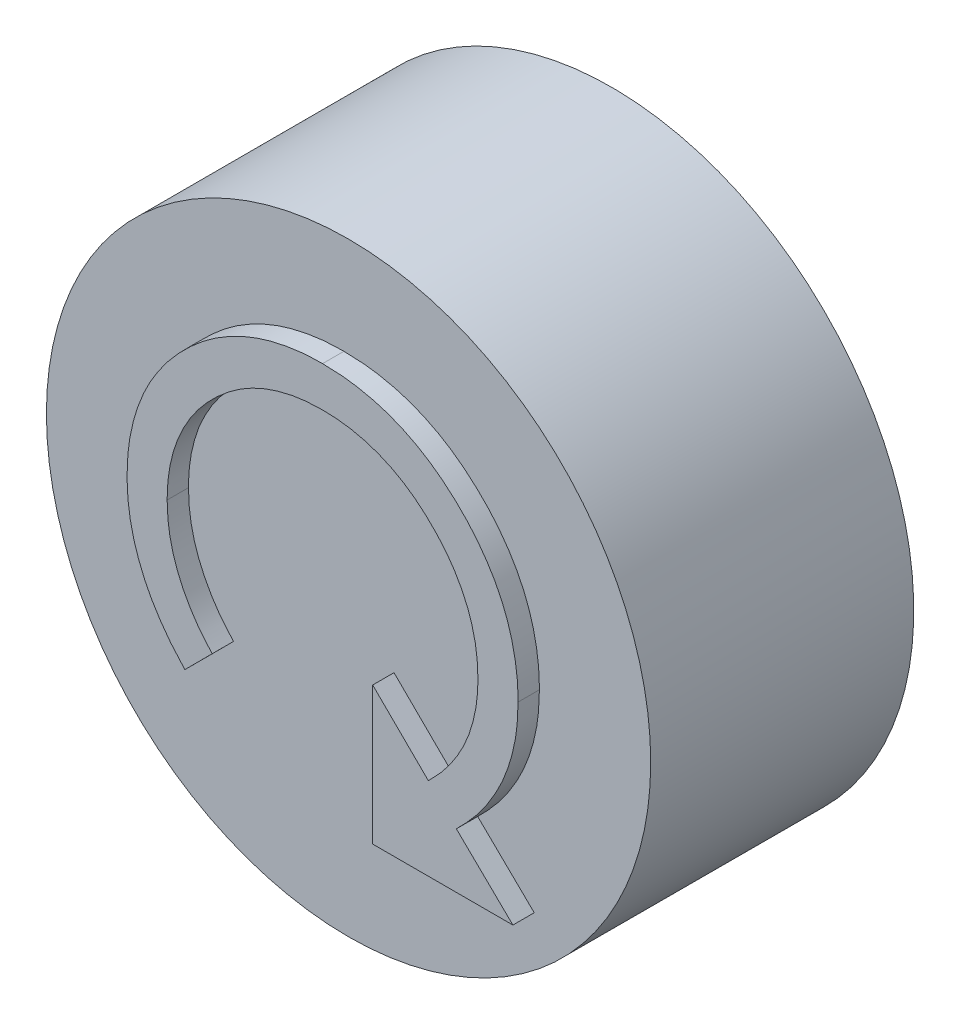
from build123d import *

# Parameters (mm, degrees)
SKETCH1_R           = 8.5
BOSS_EXTRUDE1_DEPTH = 4.4
SKETCH3_R           = 5.8
CUT_EXTRUDE1_DEPTH  = 4
BOSS_EXTRUDE3_START = 3
SKETCH4_R           = 8.5
SKETCH4_R_2         = 7.5
BOSS_EXTRUDE3_DEPTH = 3
BOSS_EXTRUDE4_DEPTH = 0.6


with BuildPart() as part:
    # Sketch1 → Boss-Extrude1 (new body)
    with BuildSketch(Plane.XY):
        Circle(SKETCH1_R)
    extrude(amount=BOSS_EXTRUDE1_DEPTH)

    # Sketch3 → Cut-Extrude1 (cut)
    with BuildSketch(Plane(origin=(0, 0, 0), x_dir=(-1, 0, 0), z_dir=(0, 0, -1))):
        Circle(SKETCH3_R)
    extrude(amount=-CUT_EXTRUDE1_DEPTH, mode=Mode.SUBTRACT)

    # Sketch4 → Boss-Extrude3 (add)
    with BuildSketch(Plane(origin=(0, 0, 0), x_dir=(-1, 0, 0), z_dir=(0, 0, -1)).offset(BOSS_EXTRUDE3_START)):
        Circle(SKETCH4_R)
        Circle(SKETCH4_R_2, mode=Mode.SUBTRACT)
    extrude(amount=-BOSS_EXTRUDE3_DEPTH)

    # Sketch6 → Cut-Revolve1 (revolve, cut)
    with BuildSketch(Plane(origin=(0, 0, 0), x_dir=(1, 0, 0), z_dir=(0, 1, 0)), mode=Mode.PRIVATE) as cut_revolve1_sk:
        Polygon((7.5, 0), (5.8, -1.7), (5.8, 0), align=None)
    revolve(cut_revolve1_sk.sketch.rotate(Axis((0, 0, -5.5), (0, 0, 1)), 180), axis=Axis((0, 0, -5.5), (0, 0, 1)), mode=Mode.SUBTRACT)

    # Sketch2 → Boss-Extrude4 (add)
    with BuildSketch(Plane.XY.offset(4.4)):
        with BuildLine():
            Line((3.632089791, -3.751482391), (5.223035304, -5.300560917))
            Line((5.223035304, -5.300560917), (1.278724407, -5.300560917))
            Line((1.278724407, -5.300560917), (1.278724407, -1.424559314))
            Line((1.278724407, -1.424559314), (2.845431137, -2.97363784))
            add(Edge.make_bspline(
                [(2.845431137, -2.97363784), (2.95632075, -2.861034584), (3.174405253, -2.639579891), (3.459213248, -2.278430368), (3.70074243, -1.902868481), (3.898794049, -1.512590066), (4.05164193, -1.107607515), (4.159151203, -0.687847174), (4.228166952, -0.253828699), (4.236197805, 0.041257842), (4.240262868, 0.190624981)],
                knots=[0, 0, 0, 0, 1.065567823, 2.095632081, 3.096325677, 4.073630942, 5.042774034, 6.010294195, 6.992849145, 8, 8, 8, 8], degree=3))
            add(Edge.make_bspline(
                [(4.240262868, 0.190624981), (4.236521971, 0.339185131), (4.229157297, 0.631654273), (4.16882099, 1.061635432), (4.066106532, 1.474567413), (3.926128217, 1.87176171), (3.742510622, 2.251822429), (3.522034828, 2.616182439), (3.260511136, 2.964392602), (2.959512286, 3.288301222), (2.634991287, 3.589186758), (2.288400016, 3.852429668), (1.924418043, 4.074704619), (1.543968163, 4.255940011), (1.147484032, 4.397650491), (0.735726783, 4.499431142), (0.30732266, 4.560199144), (0.016301238, 4.567516752), (-0.131532004, 4.571233955)],
                knots=[0, 0, 0, 0, 1.036283767, 2.0401233, 3.022098945, 4.001181535, 4.973115426, 5.961928152, 6.96848522, 8.005845645, 9.043206071, 10.052850644, 11.037284036, 12.013841621, 12.988096842, 13.970072486, 14.968836162, 16, 16, 16, 16], degree=3))
            add(Edge.make_bspline(
                [(-0.131532004, 4.571233955), (-0.280088337, 4.567459865), (-0.573277686, 4.560011356), (-1.00473588, 4.499828874), (-1.418221214, 4.397341401), (-1.816346635, 4.258767128), (-2.196115848, 4.076581392), (-2.560226583, 3.855519569), (-2.903891125, 3.590363046), (-3.230152733, 3.293680989), (-3.527552899, 2.967768525), (-3.790083641, 2.621418652), (-4.007152184, 2.255441675), (-4.192132355, 1.876734755), (-4.328849407, 1.477819774), (-4.432036389, 1.063874926), (-4.49207445, 0.632358672), (-4.499542755, 0.339177282), (-4.503326876, 0.190624981)],
                knots=[0, 0, 0, 0, 1.035427484, 2.043509704, 3.02964574, 4.001383878, 4.977134532, 5.960754486, 6.96548856, 7.998532717, 9.031576874, 10.037302222, 11.022653504, 11.993784286, 12.97035426, 13.956490296, 14.964572516, 16, 16, 16, 16], degree=3))
            add(Edge.make_bspline(
                [(-4.503326876, 0.190624981), (-4.499608767, 0.046452954), (-4.492253992, -0.238733168), (-4.430784866, -0.659467236), (-4.331445734, -1.067569513), (-4.19188491, -1.463967176), (-4.01175723, -1.848290505), (-3.795509518, -2.222691708), (-3.53699416, -2.583569925), (-3.337577276, -2.80718571), (-3.236299632, -2.920753225)],
                knots=[0, 0, 0, 0, 1.00470997, 1.987412856, 2.957385615, 3.929100441, 4.911910053, 5.912278307, 6.939710965, 8, 8, 8, 8], degree=3))
            Line((-3.236299632, -2.920753225), (-4.005330081, -3.691987199))
            add(Edge.make_bspline(
                [(-4.005330081, -3.691987199), (-4.135271474, -3.549666878), (-4.391109201, -3.269456652), (-4.719311464, -2.815225768), (-5.004332233, -2.351060045), (-5.230143754, -1.867949003), (-5.411519251, -1.371567784), (-5.538708635, -0.859768832), (-5.615741653, -0.332482335), (-5.62622625, 0.023633109), (-5.631532004, 0.203846134)],
                knots=[0, 0, 0, 0, 1.067518229, 2.101804739, 3.101067448, 4.082788766, 5.052650977, 6.026360255, 7.001235147, 8, 8, 8, 8], degree=3))
            add(Edge.make_bspline(
                [(-5.631532004, 0.203846134), (-5.627457502, 0.390708619), (-5.619432553, 0.758744313), (-5.538520982, 1.298672582), (-5.414249777, 1.818110739), (-5.235843212, 2.315782791), (-5.011649393, 2.795149888), (-4.73042278, 3.250028561), (-4.403608666, 3.686459458), (-4.028557339, 4.094332656), (-3.619894559, 4.468793147), (-3.185532677, 4.799872374), (-2.726214157, 5.075680655), (-2.248647615, 5.304538365), (-1.749434149, 5.482282496), (-1.22855864, 5.606437585), (-0.687143546, 5.687225777), (-0.318389709, 5.695331626), (-0.131532004, 5.699439083)],
                knots=[0, 0, 0, 0, 1.036548909, 2.041538722, 3.023471865, 3.997074745, 4.970976362, 5.955504589, 6.960097362, 7.993216813, 9.026336264, 10.033383207, 11.019278073, 11.994927594, 12.968530475, 13.95442534, 14.963451091, 16, 16, 16, 16], degree=3))
            add(Edge.make_bspline(
                [(-0.131532004, 5.699439083), (0.054595523, 5.695345882), (0.421895617, 5.687268445), (0.961779629, 5.606175508), (1.481981128, 5.482330381), (1.981120847, 5.30443921), (2.458381777, 5.076303735), (2.916213765, 4.799218389), (3.350458552, 4.468265022), (3.760990035, 4.094356336), (4.138315988, 3.687117495), (4.465256719, 3.250043032), (4.745894958, 2.794580246), (4.973314126, 2.316382013), (5.151012636, 1.818029141), (5.275504478, 1.29869497), (5.356356116, 0.758738455), (5.364389309, 0.390706646), (5.368467996, 0.203846134)],
                knots=[0, 0, 0, 0, 1.032739074, 2.037985287, 3.024131681, 3.997982954, 4.97388139, 5.956539052, 6.96384292, 8.000239142, 9.03637858, 10.041227652, 11.026007058, 12.001905494, 12.975756767, 13.957940427, 14.96318664, 16, 16, 16, 16], degree=3))
            add(Edge.make_bspline(
                [(5.368467996, 0.203846134), (5.363680287, 0.016248292), (5.354227058, -0.354159577), (5.270200799, -0.899409197), (5.132702079, -1.4248242), (4.943051484, -1.932209131), (4.696350305, -2.419026583), (4.396055183, -2.886430144), (4.043519788, -3.336927549), (3.770889078, -3.611628912), (3.632089791, -3.751482391)],
                knots=[0, 0, 0, 0, 1.01247621, 1.999112297, 2.970711092, 3.940884138, 4.91819732, 5.911673186, 6.936809893, 8, 8, 8, 8], degree=3))
        make_face()
    extrude(amount=BOSS_EXTRUDE4_DEPTH)


solid = part.part
